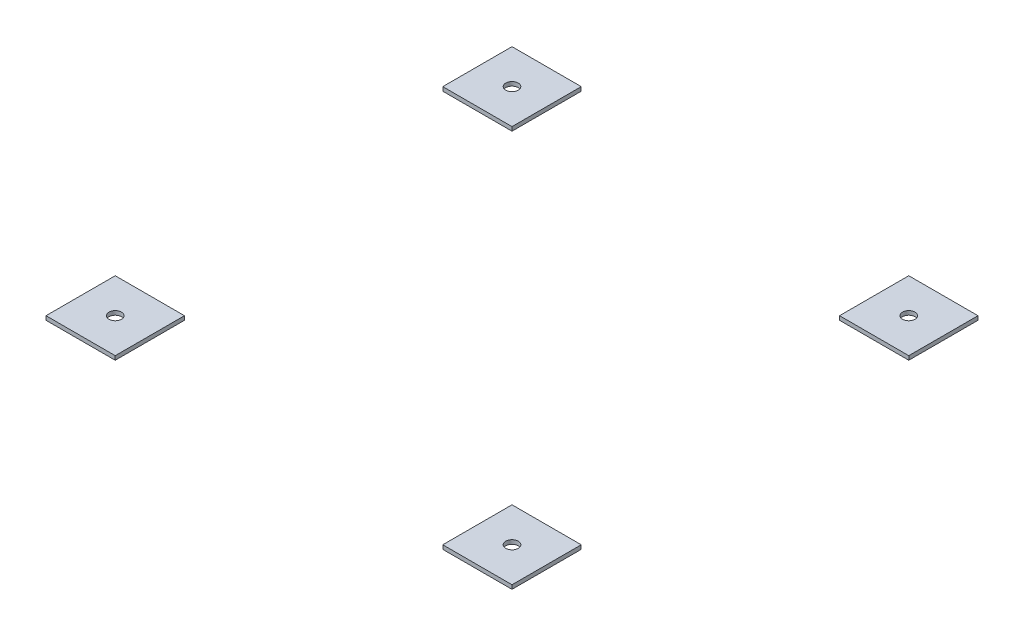
from build123d import *

# Parameters (mm, degrees)
SKETCH1_W                      = 52
SKETCH1_H                      = 52
SKETCH1_R                      = 4.68
BASE_PLATE_CORNER_TABS_DEPTH   = 1.5
BASE_PLATE_CORNER_TABS_2_DEPTH = 1.5
BASE_PLATE_CORNER_TABS_3_DEPTH = 1.5
BASE_PLATE_CORNER_TABS_4_DEPTH = 1.5


with BuildPart() as part:
    # Sketch1 → Base plate corner tabs (new, symmetric)
    with BuildSketch(Plane(origin=(0, 0, 0), x_dir=(1, 0, 0), z_dir=(0, 1, 0))):
        with Locations((149, 149)):
            Rectangle(SKETCH1_W, SKETCH1_H)
        with Locations(Location((149, 149, 0), (0, 0, 270))):
            Circle(SKETCH1_R, mode=Mode.SUBTRACT)
    extrude(amount=BASE_PLATE_CORNER_TABS_DEPTH, both=True)


with BuildPart() as body_2:
    # Sketch1 → Base plate corner tabs 2 (new, symmetric)
    with BuildSketch(Plane(origin=(0, 0, 0), x_dir=(1, 0, 0), z_dir=(0, 1, 0))):
        with Locations((-149, 149)):
            Rectangle(SKETCH1_W, SKETCH1_H)
        with Locations(Location((-149, 149, 0), (0, 0, 270))):
            Circle(SKETCH1_R, mode=Mode.SUBTRACT)
    extrude(amount=BASE_PLATE_CORNER_TABS_2_DEPTH, both=True)


with BuildPart() as body_3:
    # Sketch1 → Base plate corner tabs 3 (new, symmetric)
    with BuildSketch(Plane(origin=(0, 0, 0), x_dir=(1, 0, 0), z_dir=(0, 1, 0))):
        with Locations((149, -149)):
            Rectangle(SKETCH1_W, SKETCH1_H)
        with Locations(Location((149, -149, 0), (0, 0, 270))):
            Circle(SKETCH1_R, mode=Mode.SUBTRACT)
    extrude(amount=BASE_PLATE_CORNER_TABS_3_DEPTH, both=True)


with BuildPart() as body_4:
    # Sketch1 → Base plate corner tabs 4 (new, symmetric)
    with BuildSketch(Plane(origin=(0, 0, 0), x_dir=(1, 0, 0), z_dir=(0, 1, 0))):
        with Locations((-149, -149)):
            Rectangle(SKETCH1_W, SKETCH1_H)
        with Locations(Location((-149, -149, 0), (0, 0, 270))):
            Circle(SKETCH1_R, mode=Mode.SUBTRACT)
    extrude(amount=BASE_PLATE_CORNER_TABS_4_DEPTH, both=True)


solid = Compound([part.part, body_2.part, body_3.part, body_4.part])
